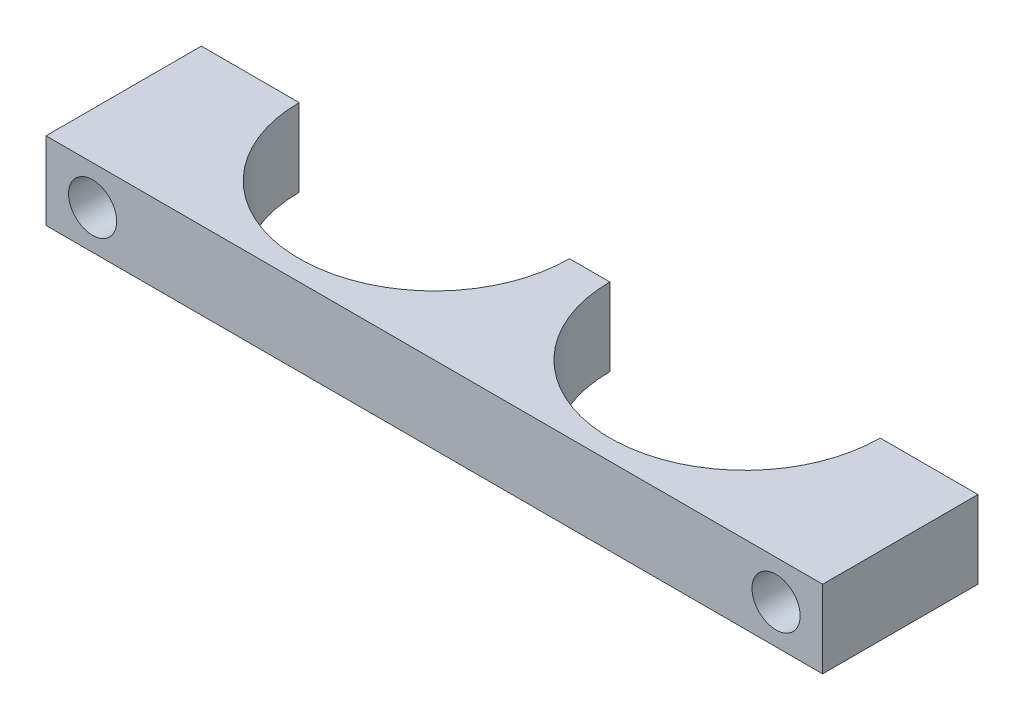
from build123d import *

# Parameters (mm, degrees)
BOSS_EXTRUDE1_DEPTH = 10
SKETCH2_R           = 3.1
CUT_EXTRUDE1_DEPTH  = 70.110171815


with BuildPart() as part:
    # Sketch1 → Boss-Extrude1 (new body)
    with BuildSketch(Plane(origin=(0, 0, 0), x_dir=(1, 0, 0), z_dir=(0, 1, 0))):
        with BuildLine():
            Line((12.792781316, -1.762208068), (17.992781316, -1.762208068))
            ThreePointArc((17.992781316, -1.762208068), (35.392781316, -19.162208068), (52.792781316, -1.762208068))
            Line((52.792781316, -1.762208068), (65.392781316, -1.762208068))
            Line((65.392781316, -1.762208068), (65.392781316, -21.762208068))
            Line((65.392781316, -21.762208068), (-34.607218684, -21.762208068))
            Line((-34.607218684, -21.762208068), (-34.607218684, -1.762208068))
            Line((-34.607218684, -1.762208068), (-22.007218684, -1.762208068))
            ThreePointArc((-22.007218684, -1.762208068), (-4.607218684, -19.162208068), (12.792781316, -1.762208068))
        make_face()
    extrude(amount=BOSS_EXTRUDE1_DEPTH)

    # Sketch2 → Cut-Extrude1 (cut, through all)
    with BuildSketch(Plane.XY.offset(21.762208068)):
        with Locations((-28.607218684, 5)):
            Circle(SKETCH2_R)
        with Locations((59.392781316, 5)):
            Circle(SKETCH2_R)
    extrude(amount=-CUT_EXTRUDE1_DEPTH, mode=Mode.SUBTRACT)


solid = part.part
